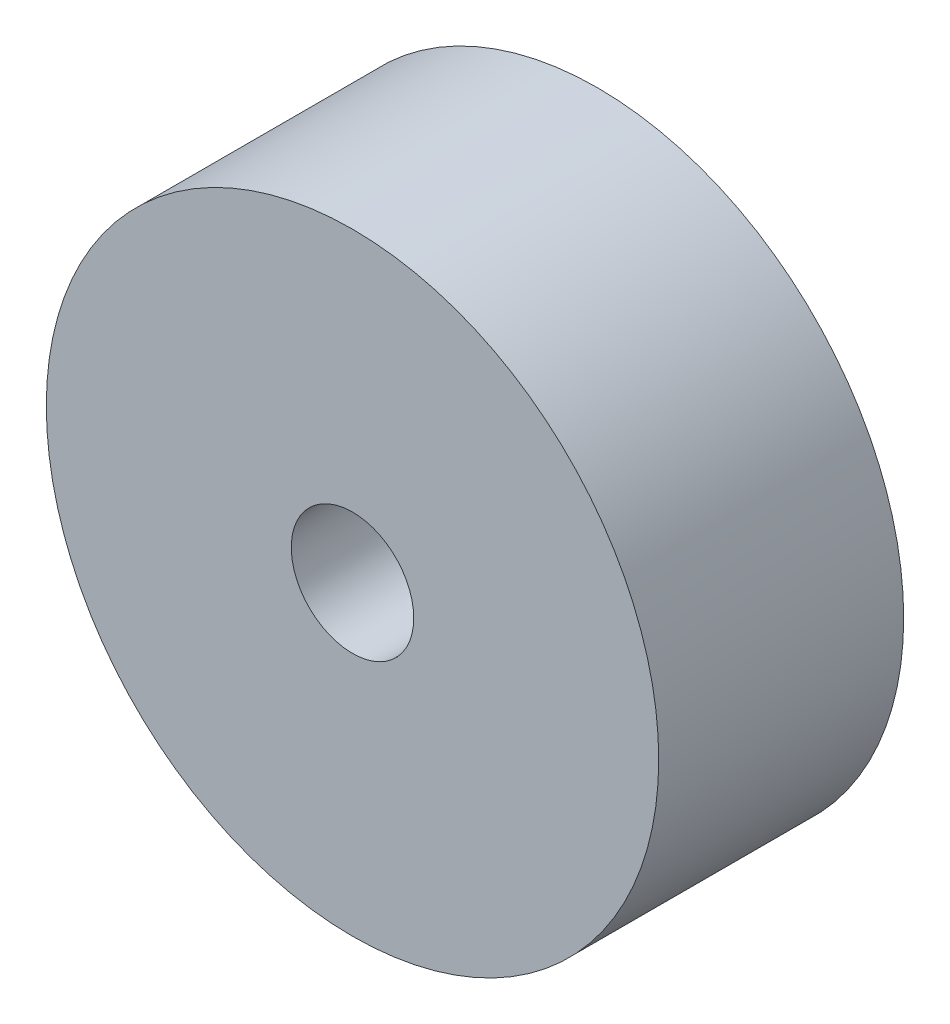
from build123d import *

# Parameters (mm, degrees)
BOSS_EXTRUDE1_START = 4.5
SKETCH1_R           = 15
BOSS_EXTRUDE1_DEPTH = 12
SKETCH2_R           = 3
CUT_EXTRUDE1_DEPTH  = 20


with BuildPart() as part:
    # Sketch1 → Boss-Extrude1 (new body)
    with BuildSketch(Plane.XY.offset(BOSS_EXTRUDE1_START)):
        with Locations((50, 0)):
            Circle(SKETCH1_R)
    extrude(amount=BOSS_EXTRUDE1_DEPTH)

    # Sketch2 → Cut-Extrude1 (cut)
    with BuildSketch(Plane.XY.offset(16.5)):
        with Locations((50, 0)):
            Circle(SKETCH2_R)
    extrude(amount=-CUT_EXTRUDE1_DEPTH, mode=Mode.SUBTRACT)


solid = part.part
